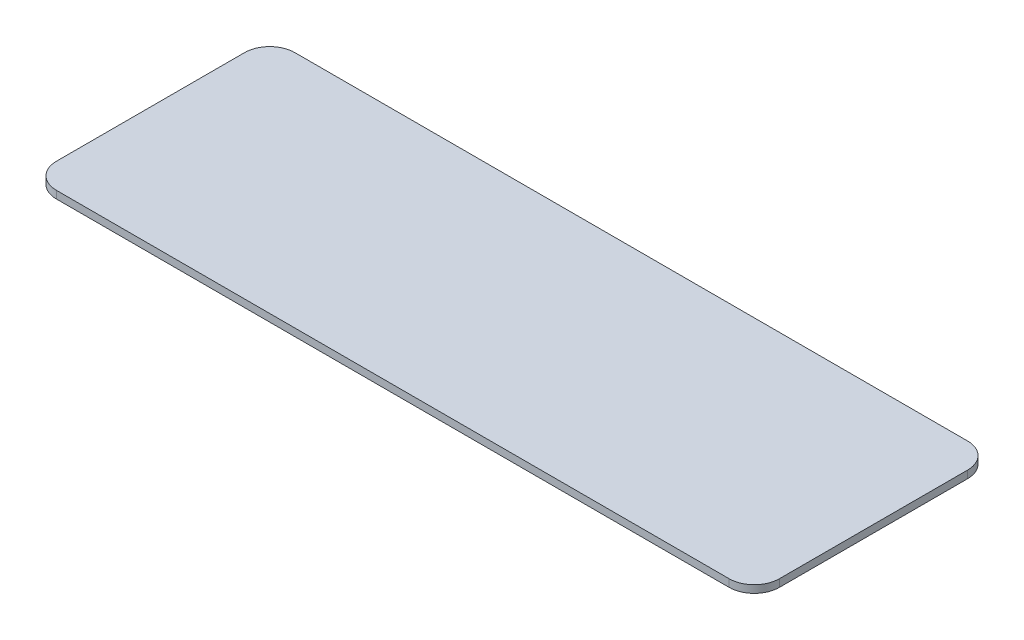
from build123d import *

# Parameters (mm, degrees)
SKETCH1_W           = 288
SKETCH1_H           = 95
BOSS_EXTRUDE1_DEPTH = 3
SKETCH2_W           = 248
SKETCH2_H           = 75
BOSS_EXTRUDE2_DEPTH = 6
FILLET1_R           = 10
FILLET2_R           = 5


with BuildPart() as part:
    # Sketch1 → Boss-Extrude1 (new body)
    with BuildSketch(Plane(origin=(0, 0, 0), x_dir=(1, 0, 0), z_dir=(0, 1, 0))):
        with Locations((92.582008252, -21.664979636)):
            Rectangle(SKETCH1_W, SKETCH1_H)
    extrude(amount=BOSS_EXTRUDE1_DEPTH)

    # Sketch2 → Boss-Extrude2 (add)
    with BuildSketch(Plane.XZ):
        with Locations((92.582008252, 11.664979636)):
            Rectangle(SKETCH2_W, SKETCH2_H)
    extrude(amount=BOSS_EXTRUDE2_DEPTH)

    # Fillet1
    fillet1_edges = [part.edges().sort_by_distance(p)[0] for p in [
        (236.582008252, 1.5, -25.835020364),
        (-51.417991748, 1.5, -25.835020364),
        (236.582008252, 1.5, 69.164979636),
        (-51.417991748, 1.5, 69.164979636),
    ]]
    fillet(fillet1_edges, radius=FILLET1_R)

    # Fillet2
    fillet2_edges = [part.edges().sort_by_distance(p)[0] for p in [
        (-31.417991748, -3, 49.164979636),
        (-31.417991748, -3, -25.835020364),
        (216.582008252, -3, -25.835020364),
        (216.582008252, -3, 49.164979636),
    ]]
    fillet(fillet2_edges, radius=FILLET2_R)


solid = part.part
